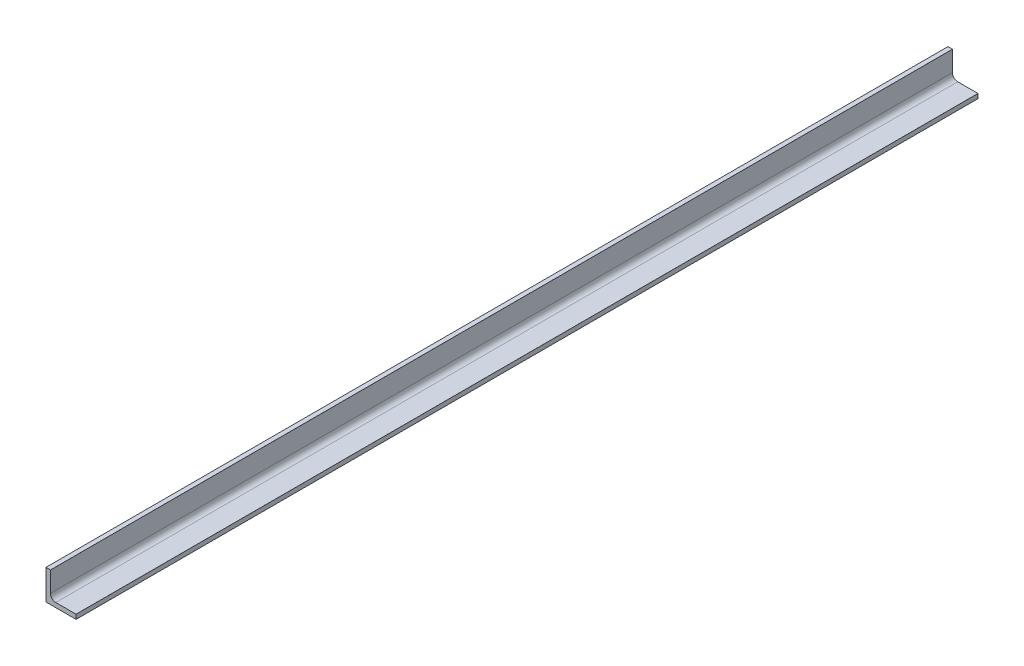
from build123d import *

# Parameters (mm, degrees)
EXTRUDE_1_DEPTH = 600


with BuildPart() as part:
    # 草图1 → 拉伸1 (new body)
    with BuildSketch(Plane.XY):
        with BuildLine():
            Line((0, 0), (0, 20))
            Line((0, 20), (2.99, 20))
            ThreePointArc((2.99, 20), (2.997071068, 19.997071068), (3, 19.99))
            Line((3, 19.99), (3, 6.5))
            ThreePointArc((3, 6.5), (4.025126266, 4.025126266), (6.5, 3))
            Line((6.5, 3), (19.99, 3))
            ThreePointArc((19.99, 3), (19.997071068, 2.997071068), (20, 2.99))
            Line((20, 2.99), (20, 0))
            Line((20, 0), (0, 0))
        make_face()
    extrude(amount=EXTRUDE_1_DEPTH)


solid = part.part
